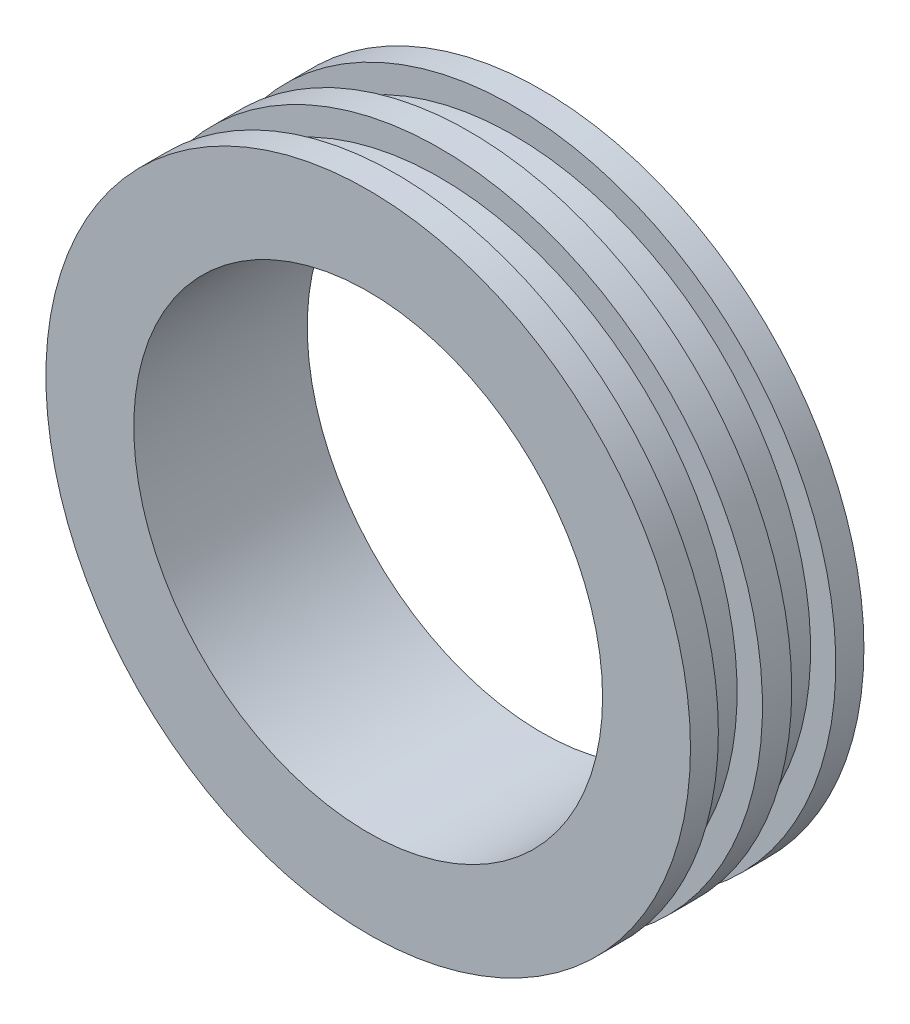
from build123d import *

# Parameters (mm, degrees)
SKETCH1_R           = 34.925
SKETCH1_R_2         = 25.4
BOSS_EXTRUDE1_DEPTH = 18.796


with BuildPart() as part:
    # Sketch1 → Boss-Extrude1 (new body)
    with BuildSketch(Plane.XY):
        Circle(SKETCH1_R)
        Circle(SKETCH1_R_2, mode=Mode.SUBTRACT)
    extrude(amount=BOSS_EXTRUDE1_DEPTH)

    # Cut-Sweep1: sweep along a path in groove path
    with BuildLine(Plane.XY.offset(11.0109)) as cut_sweep1_path:
        CenterArc((0, 0), 34.925, 0, 360)
    # groove → Cut-Sweep1 (sweep, cut)
    with BuildSketch(Plane(origin=(0, 0, 0), x_dir=(0, 0, -1), z_dir=(1, 0, 0))):
        Polygon((-15.7734, 34.987595096), (-15.7734, 32.193595096), (-11.0109, 32.193595096), (-10.9982, 34.987595096), (-7.8232, 34.987595096), (-7.8232, 32.193595096), (-3.048, 32.193595096), (-3.048, 34.987595096), (-3.048, 38.125839406), (-15.7734, 38.125839406), align=None)
    sweep(path=cut_sweep1_path.line, mode=Mode.SUBTRACT)


solid = part.part
